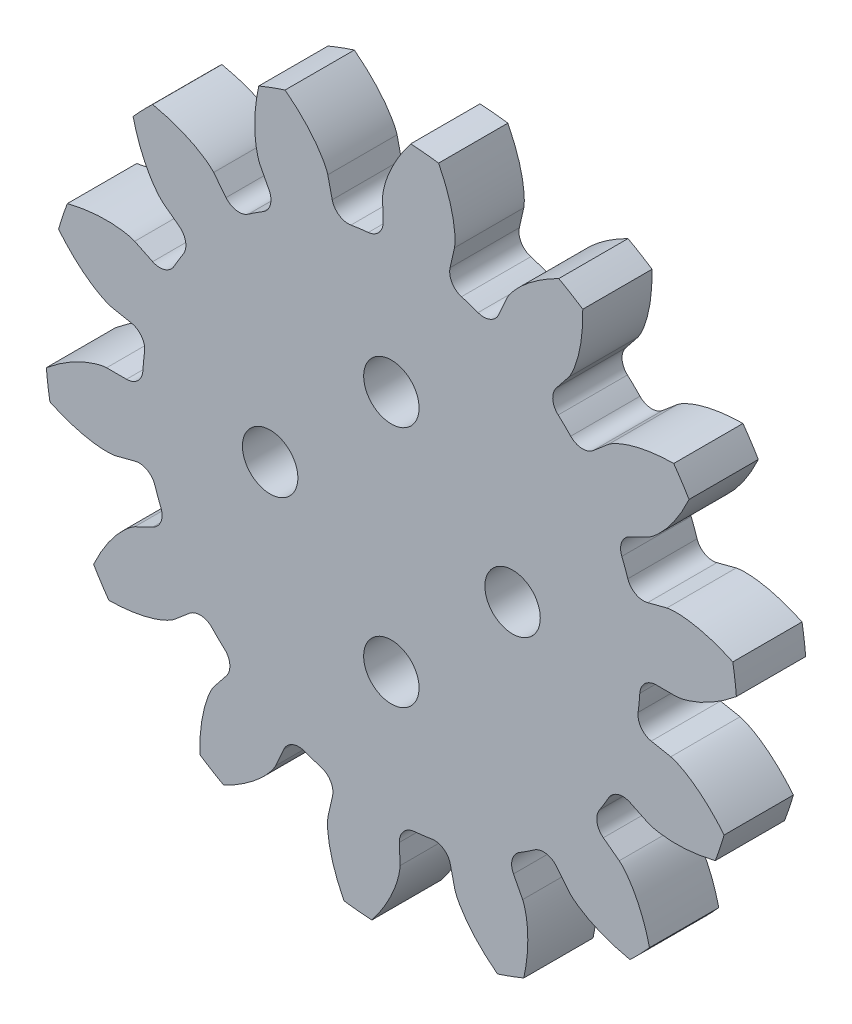
from build123d import *

# Parameters (mm, degrees)
SKETCH_2_R                       = 20
EXTRUDE_1_DEPTH                  = 4
CUT_EXTRUDE_START                = -4
CUT_EXTRUDE_1_DEPTH              = 4
FILLET_1_R                       = 0.95
PATTERN_CIRCULAR_1_COUNT         = 14
PATTERN_CIRCULAR_1_ANGLE         = 334.23
FILLET_1_OF_PATTERN_CIRCULAR_1_R = 0.95
SKETCH_4_R                       = 1.6
CUT_EXTRUDE_2_DEPTH              = 4
PATTERN_CIRCULAR_2_COUNT         = 4


with BuildPart() as part:
    # 草圖2 → 填料-伸長1 (new body)
    with BuildSketch(Plane.XY):
        Circle(SKETCH_2_R)
    extrude(amount=EXTRUDE_1_DEPTH)

    # 草圖3 → 除料-伸長1 (cut)
    with BuildSketch(Plane.XY.offset(4).offset(CUT_EXTRUDE_START)):
        with BuildLine():
            Line((16.135528894, -3.173367716), (14.104808483, -2.773986783))
            ThreePointArc((14.104808483, -2.773986783), (14.307292667, -1.393557151), (14.375, 0))
            Line((14.375, 0), (16.444620864, 0))
            add(Edge.make_bspline(
                [(16.444620864, 0), (16.45212026, 0.000124624), (16.473145735, 0.000860016), (16.512850033, 0.003773737), (16.577499697, 0.01068842), (16.659615822, 0.022668126), (16.765351073, 0.04178011), (16.889295367, 0.068944579), (17.024738677, 0.103648166), (17.171138228, 0.146610098), (17.316248247, 0.194051904), (17.460031164, 0.245614778), (17.60232604, 0.300785992), (17.773487614, 0.372080153), (17.976991277, 0.4637574), (18.212071236, 0.579828354), (18.475205241, 0.721918835), (18.739306783, 0.87773405), (18.99571765, 1.040047661), (19.250469745, 1.21419212), (19.493871749, 1.389869605), (19.698330547, 1.548675204), (19.831327041, 1.655085944), (19.907345467, 1.717716203), (19.924843457, 1.732227816)],
                knots=[0, 0, 0, 0, 0, 0.005376749, 0.015083688, 0.02853182, 0.046610139, 0.064854849, 0.092110525, 0.119476176, 0.146842496, 0.174208854, 0.201574956, 0.228941013, 0.256307345, 0.307035032, 0.361767352, 0.416499661, 0.471231936, 0.525964282, 0.580696615, 0.635428982, 0.690161387, 0.706456878, 0.706456878, 0.706456878, 0.706456878, 0.706456878], degree=4))
            ThreePointArc((19.924843457, 1.732227816), (19.905798494, -1.938862122), (19.216064274, -5.544625669))
            add(Edge.make_bspline(
                [(16.135528894, -3.173367716), (16.142863283, -3.174937178), (16.163351654, -3.179716098), (16.201747403, -3.19023691), (16.263847569, -3.209497264), (16.342108486, -3.237097994), (16.442168247, -3.276254798), (16.558540883, -3.326826588), (16.684741556, -3.38701479), (16.820098898, -3.457420372), (16.953326452, -3.53197278), (17.084456593, -3.610312701), (17.213430349, -3.691905989), (17.367616935, -3.794889671), (17.549604324, -3.92411447), (17.757867177, -4.083367846), (17.988635707, -4.27356536), (18.217705086, -4.477416349), (18.437974329, -4.686159496), (18.654332943, -4.906191023), (18.85925897, -5.125536498), (19.029229582, -5.320812225), (19.139191884, -5.450887607), (19.201695524, -5.527010176), (19.216064274, -5.544625669)],
                knots=[0, 0, 0, 0, 0, 0.005376749, 0.015083688, 0.02853182, 0.046610139, 0.064854849, 0.092110525, 0.119476176, 0.146842496, 0.174208854, 0.201574956, 0.228941013, 0.256307345, 0.307035032, 0.361767352, 0.416499661, 0.471231936, 0.525964282, 0.580696615, 0.635428982, 0.690161387, 0.706456878, 0.706456878, 0.706456878, 0.706456878, 0.706456878], degree=4))
        make_face()
    cut_extrude_1 = extrude(amount=CUT_EXTRUDE_1_DEPTH, mode=Mode.SUBTRACT)

    # 圓角1
    fillet_1_edges = [part.edges().sort_by_distance(p)[0] for p in [
        (14.104808483, -2.773986783, 2),
        (14.375, 0, 2),
    ]]
    fillet(fillet_1_edges, radius=FILLET_1_R)

    # 環狀複製排列1: 除料-伸長1 ×14 about axis
    pattern_circular_1_axis = Axis((0, 0, 4), (0, 0, -1))
    for i in range(1, PATTERN_CIRCULAR_1_COUNT):
        add(cut_extrude_1.rotate(pattern_circular_1_axis, i * PATTERN_CIRCULAR_1_ANGLE / (PATTERN_CIRCULAR_1_COUNT - 1)), mode=Mode.SUBTRACT)

    # 圓角1 of 環狀複製排列1
    fillet_1_of_pattern_circular_1_edges = [part.edges().sort_by_distance(p)[0] for p in [
        (11.50505025, -8.618262224, 2),
        (12.951893972, -6.236109968, 2),
        (6.627322436, -12.756144493, 2),
        (8.964347126, -11.237486623, 2),
        (0.437402274, -14.368343824, 2),
        (3.201883211, -14.01387059, 2),
        (-5.839122384, -13.135649005, 2),
        (-3.194545127, -14.015545171, 2),
        (-10.959516223, -9.302130356, 2),
        (-8.958461963, -11.242178804, 2),
        (-13.909954778, -3.626814451, 2),
        (-12.948626977, -6.242890709, 2),
        (-14.106259005, 2.766601142, 2),
        (-14.37499803, -0.007526732, 2),
        (-11.509561184, 8.612237012, 2),
        (-12.955157416, 6.229327518, 2),
        (-6.634000629, 12.752672687, 2),
        (-8.970229831, 11.232791362, 2),
        (-0.444925461, 14.368112831, 2),
        (-3.209220418, 14.012192166, 2),
        (5.832243774, 13.138704562, 2),
        (3.187206168, 14.017215909, 2),
        (10.954644137, 9.30786747, 2),
        (8.952574345, 11.246867902, 2),
        (13.908053876, 3.634097189, 2),
        (12.945356433, 6.249669738, 2),
    ]]
    fillet(fillet_1_of_pattern_circular_1_edges, radius=FILLET_1_OF_PATTERN_CIRCULAR_1_R)

    # 草圖4 → 除料-伸長2 (cut)
    with BuildSketch(Plane.XY.offset(4)):
        with Locations((7, 0)):
            Circle(SKETCH_4_R)
    cut_extrude_2 = extrude(amount=-CUT_EXTRUDE_2_DEPTH, mode=Mode.SUBTRACT)

    # 環狀複製排列2: 除料-伸長2 ×4 about axis
    pattern_circular_2_axis = Axis((0, 0, 0), (0, 0, 1))
    for i in range(1, PATTERN_CIRCULAR_2_COUNT):
        add(cut_extrude_2.rotate(pattern_circular_2_axis, i * 360 / PATTERN_CIRCULAR_2_COUNT), mode=Mode.SUBTRACT)


solid = part.part
